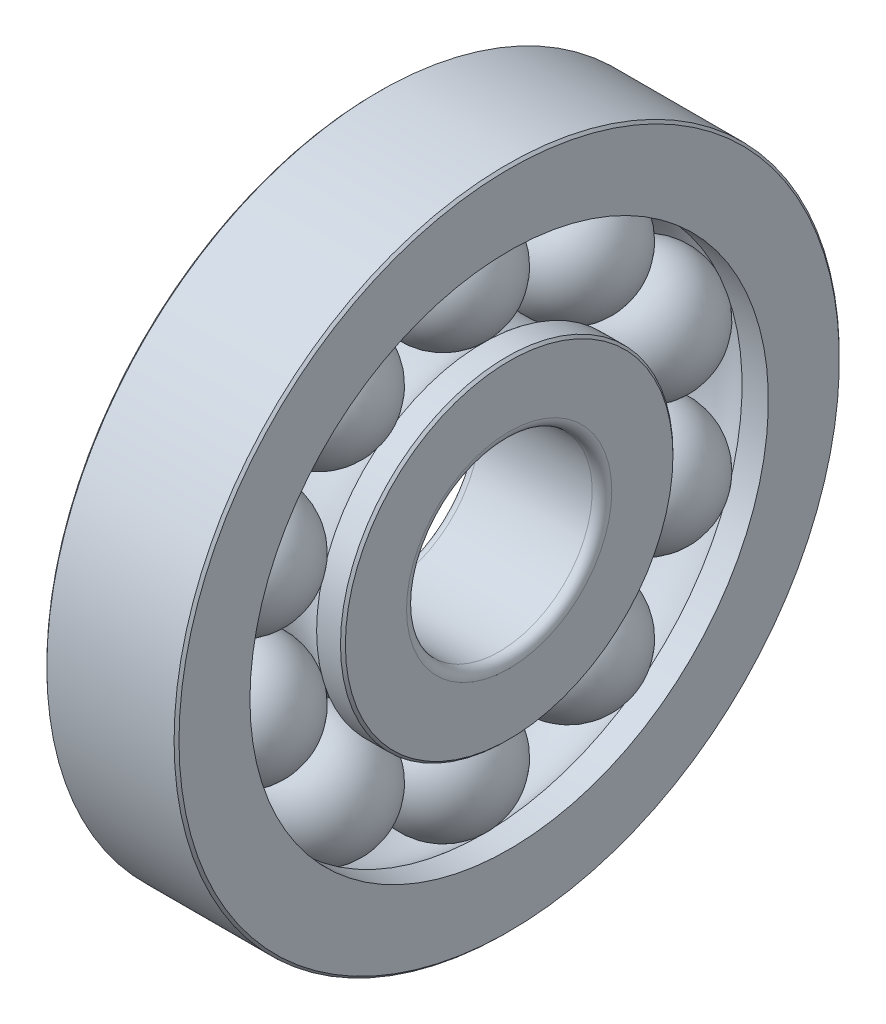
from build123d import *

# Parameters (mm, degrees)
CIRPATTERN1_COUNT = 10
CHAMFER1_SIZE     = 0.5
CHAMFER2_SIZE     = 0.5
FILLET1_R         = 2
CHAMFER3_SIZE     = 0.5
CHAMFER4_SIZE     = 0.5


with BuildPart() as part:
    # Sketch1 → Revolve4 (revolve)
    with BuildSketch(Plane.XY):
        with BuildLine():
            Line((-12.5, 0), (12.5, 0))
            ThreePointArc((12.5, 0), (0, 12.5), (-12.5, 0))
        make_face()
    revolve(axis=Axis((-60.917011617, 0, 0), (1, 0, 0)))


with BuildPart() as body_2:
    # Sketch2 → Revolve5 (revolve)
    with BuildSketch(Plane.XY, mode=Mode.PRIVATE) as revolve5_sk:
        with BuildLine():
            Line((8.124038405, -9.5), (13.5, -9.5))
            Line((13.5, -9.5), (13.5, -24.5))
            Line((13.5, -24.5), (-13.5, -24.5))
            Line((-13.5, -24.5), (-13.5, -9.5))
            Line((-13.5, -9.5), (-8.124038405, -9.5))
            ThreePointArc((-8.124038405, -9.5), (0, -12.5), (8.124038405, -9.5))
        make_face()
        with BuildLine():
            Line((-13.5, 24.5), (13.5, 24.5))
            Line((13.5, 24.5), (13.5, 9.5))
            Line((13.5, 9.5), (8.124038405, 9.5))
            ThreePointArc((8.124038405, 9.5), (0, 12.5), (-8.124038405, 9.5))
            Line((-8.124038405, 9.5), (-13.5, 9.5))
            Line((-13.5, 9.5), (-13.5, 24.5))
        make_face()
    revolve(revolve5_sk.sketch.rotate(Axis((-34.492193655, -43.469148445, 0), (1, 0, 0)), 90), axis=Axis((-34.492193655, -43.469148445, 0), (1, 0, 0)))

    # Chamfer1
    chamfer1_edges = [body_2.edges().sort_by_distance(p)[0] for p in [
        (13.5, -43.469148445, -67.969148445),
    ]]
    chamfer(chamfer1_edges, length=CHAMFER1_SIZE)

    # Chamfer2
    chamfer2_edges = [body_2.edges().sort_by_distance(p)[0] for p in [
        (13.5, -43.469148445, -33.969148445),
    ]]
    chamfer(chamfer2_edges, length=CHAMFER2_SIZE)

    # Fillet1
    fillet1_edges = [body_2.edges().sort_by_distance(p)[0] for p in [
        (13.5, -43.469148445, -18.969148445),
        (-13.5, -43.469148445, -18.969148445),
    ]]
    fillet(fillet1_edges, radius=FILLET1_R)

    # Chamfer3
    chamfer3_edges = [body_2.edges().sort_by_distance(p)[0] for p in [
        (-13.5, -43.469148445, -67.969148445),
    ]]
    chamfer(chamfer3_edges, length=CHAMFER3_SIZE)

    # Chamfer4
    chamfer4_edges = [body_2.edges().sort_by_distance(p)[0] for p in [
        (-13.5, -43.469148445, -33.969148445),
    ]]
    chamfer(chamfer4_edges, length=CHAMFER4_SIZE)


with BuildPart() as cirpattern1_1:
    # CirPattern1: pattern copy
    add(part.part.rotate(Axis((0, -43.469148445, 0), (1, 0, 0)), 1 * 360 / CIRPATTERN1_COUNT))


with BuildPart() as cirpattern1_2:
    # CirPattern1: pattern copy
    add(part.part.rotate(Axis((0, -43.469148445, 0), (1, 0, 0)), 2 * 360 / CIRPATTERN1_COUNT))


with BuildPart() as cirpattern1_3:
    # CirPattern1: pattern copy
    add(part.part.rotate(Axis((0, -43.469148445, 0), (1, 0, 0)), 3 * 360 / CIRPATTERN1_COUNT))


with BuildPart() as cirpattern1_4:
    # CirPattern1: pattern copy
    add(part.part.rotate(Axis((0, -43.469148445, 0), (1, 0, 0)), 4 * 360 / CIRPATTERN1_COUNT))


with BuildPart() as cirpattern1_5:
    # CirPattern1: pattern copy
    add(part.part.rotate(Axis((0, -43.469148445, 0), (1, 0, 0)), 5 * 360 / CIRPATTERN1_COUNT))


with BuildPart() as cirpattern1_6:
    # CirPattern1: pattern copy
    add(part.part.rotate(Axis((0, -43.469148445, 0), (1, 0, 0)), 6 * 360 / CIRPATTERN1_COUNT))


with BuildPart() as cirpattern1_7:
    # CirPattern1: pattern copy
    add(part.part.rotate(Axis((0, -43.469148445, 0), (1, 0, 0)), 7 * 360 / CIRPATTERN1_COUNT))


with BuildPart() as cirpattern1_8:
    # CirPattern1: pattern copy
    add(part.part.rotate(Axis((0, -43.469148445, 0), (1, 0, 0)), 8 * 360 / CIRPATTERN1_COUNT))


with BuildPart() as cirpattern1_9:
    # CirPattern1: pattern copy
    add(part.part.rotate(Axis((0, -43.469148445, 0), (1, 0, 0)), 9 * 360 / CIRPATTERN1_COUNT))


solid = Compound([part.part, body_2.part, cirpattern1_1.part, cirpattern1_2.part, cirpattern1_3.part, cirpattern1_4.part, cirpattern1_5.part, cirpattern1_6.part, cirpattern1_7.part, cirpattern1_8.part, cirpattern1_9.part])
